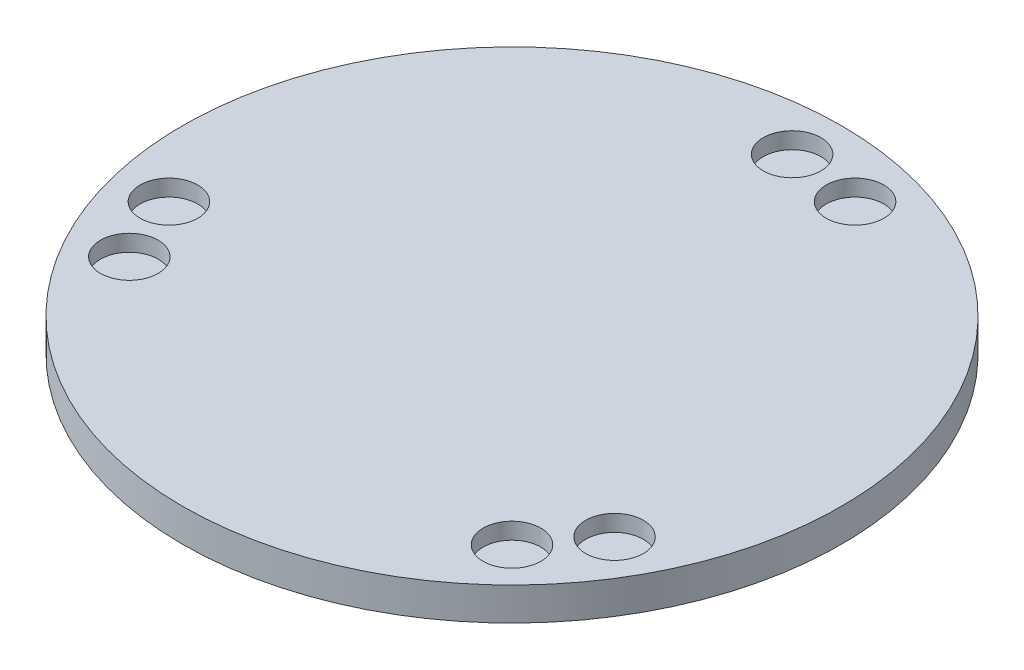
from build123d import *

# Parameters (mm, degrees)
SKETCH1_R          = 200
EXTRUDE1_DEPTH     = 20
SKETCH2_R          = 17.5
CUT_EXTRUDE1_DEPTH = 10


with BuildPart() as part:
    # Sketch1 → Extrude1 (new body)
    with BuildSketch(Plane(origin=(0, 0, 0), x_dir=(1, 0, 0), z_dir=(0, 1, 0))):
        with Locations(Location((0, 0, 0), (0, 0, 270))):
            Circle(SKETCH1_R)
    extrude(amount=-EXTRUDE1_DEPTH)

    # Sketch2 → Cut-Extrude1 (cut)
    with BuildSketch(Plane(origin=(0, 0, 0), x_dir=(1, 0, 0), z_dir=(0, 1, 0))):
        with Locations(Location((0, 170, 0), (0, 0, 270))):
            Circle(SKETCH2_R)
        with Locations(Location((43.999237667, 164.207390469, 0), (0, 0, 270))):
            Circle(SKETCH2_R)
        with Locations(Location((147.224318643, -85, 0), (0, 0, 270))):
            Circle(SKETCH2_R)
        with Locations(Location((120.208152802, -120.208152802, 0), (0, 0, 270))):
            Circle(SKETCH2_R)
        with Locations(Location((-147.224318643, -85, 0), (0, 0, 270))):
            Circle(SKETCH2_R)
        with Locations(Location((-164.207390469, -43.999237667, 0), (0, 0, 270))):
            Circle(SKETCH2_R)
    extrude(amount=-CUT_EXTRUDE1_DEPTH, mode=Mode.SUBTRACT)


solid = part.part
